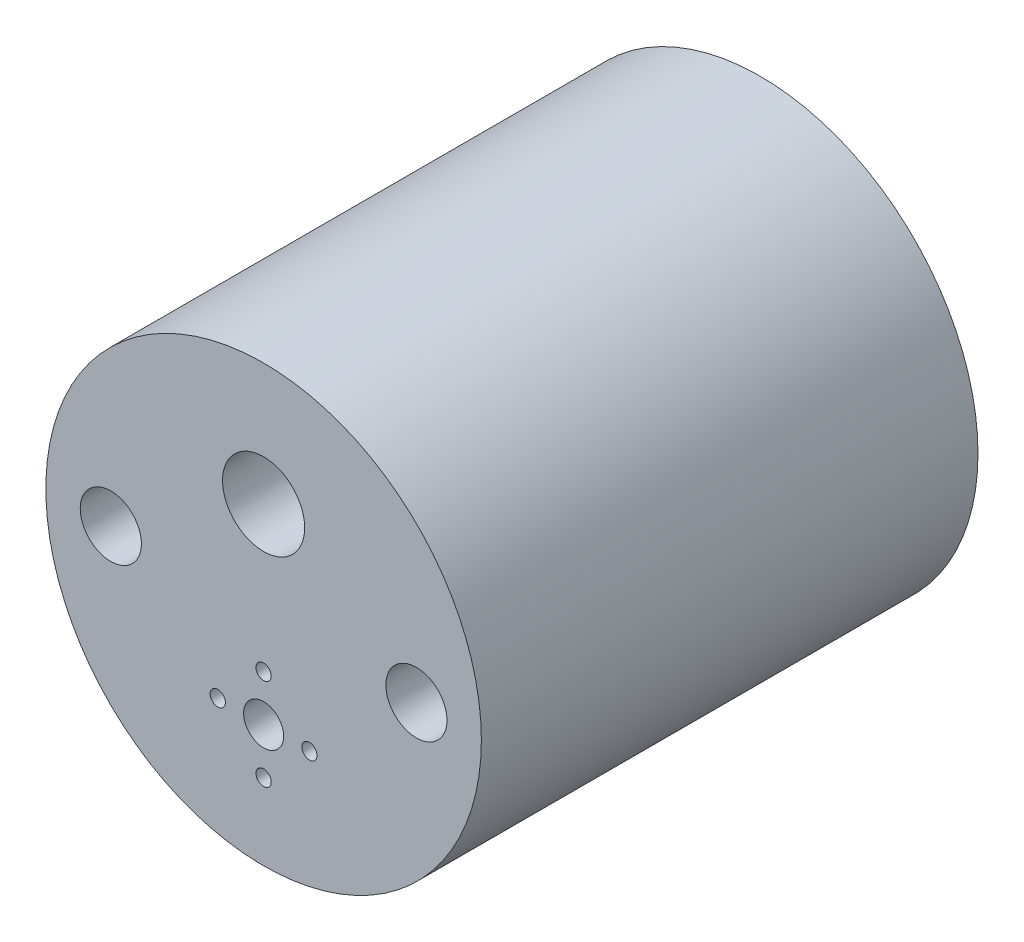
from build123d import *

# Parameters (mm, degrees)
SKETCH1_R           = 57
SKETCH1_R_2         = 2
SKETCH1_R_3         = 5.25
SKETCH1_R_4         = 10.75
BOSS_EXTRUDE1_DEPTH = 20
SKETCH2_R           = 57
SKETCH2_R_2         = 54
BOSS_EXTRUDE2_DEPTH = 130
SKETCH3_R           = 8
CUT_EXTRUDE1_DEPTH  = 19.5
SKETCH5_R           = 12
CUT_EXTRUDE3_DEPTH  = 6.05


with BuildPart() as part:
    # Sketch1 → Boss-Extrude1 (new body)
    with BuildSketch(Plane.XY):
        with Locations((0, 25)):
            Circle(SKETCH1_R)
        with Locations((12, 0)):
            Circle(SKETCH1_R_2, mode=Mode.SUBTRACT)
        with Locations((0, -12)):
            Circle(SKETCH1_R_2, mode=Mode.SUBTRACT)
        with Locations((-12, 0)):
            Circle(SKETCH1_R_2, mode=Mode.SUBTRACT)
        Circle(SKETCH1_R_3, mode=Mode.SUBTRACT)
        with Locations((0, 12)):
            Circle(SKETCH1_R_2, mode=Mode.SUBTRACT)
        with Locations((0, 50)):
            Circle(SKETCH1_R_4, mode=Mode.SUBTRACT)
    extrude(amount=-BOSS_EXTRUDE1_DEPTH)

    # Sketch2 → Boss-Extrude2 (add)
    with BuildSketch(Plane.XY):
        with Locations((0, 25)):
            Circle(SKETCH2_R)
        with Locations((0, 25)):
            Circle(SKETCH2_R_2, mode=Mode.SUBTRACT)
    extrude(amount=-BOSS_EXTRUDE2_DEPTH)

    # Sketch3 → Cut-Extrude1 (cut)
    with BuildSketch(Plane.XY):
        with Locations((40, 25)):
            Circle(SKETCH3_R)
    cut_extrude1 = extrude(amount=-CUT_EXTRUDE1_DEPTH, mode=Mode.SUBTRACT)

    # Sketch5 → Cut-Extrude3 (cut)
    with BuildSketch(Plane(origin=(0, 0, -20), x_dir=(-1, 0, 0), z_dir=(0, 0, -1))):
        with Locations((-40, 25)):
            Circle(SKETCH5_R)
    cut_extrude3 = extrude(amount=-CUT_EXTRUDE3_DEPTH, mode=Mode.SUBTRACT)

    # Mirror1: Cut-Extrude1, Cut-Extrude3 across plane
    add(cut_extrude1.mirror(Plane(origin=(0, 0, 0), x_dir=(0, 0, 1), z_dir=(1, 0, 0))), mode=Mode.SUBTRACT)
    add(cut_extrude3.mirror(Plane(origin=(0, 0, 0), x_dir=(0, 0, 1), z_dir=(1, 0, 0))), mode=Mode.SUBTRACT)


solid = part.part
